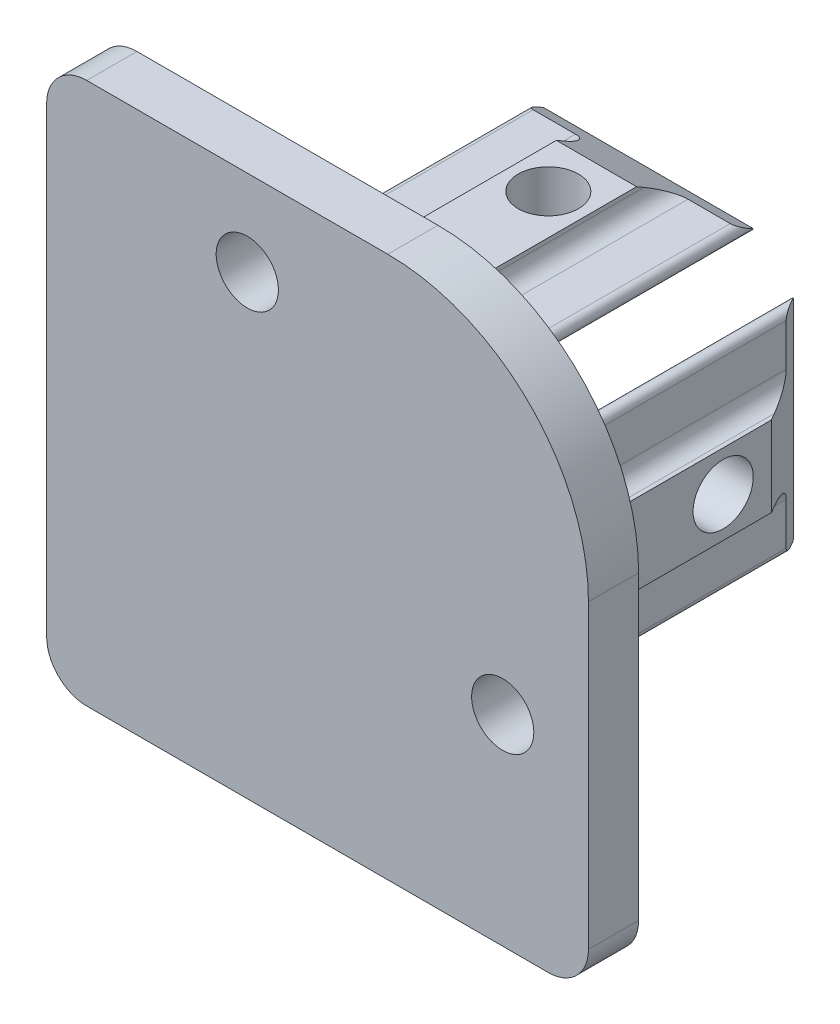
from build123d import *

# Parameters (mm, degrees)
BOSS_EXTRUDE2_DEPTH           = 20
CHAMFER2_SIZE                 = 1.5
CHAMFER2_SIZE2                = 2.598076211
SKETCH4_R                     = 1.5
CUT_EXTRUDE1_DEPTH            = 22.185810788
SKETCH6_W                     = 27
SKETCH6_H                     = 27
BOSS_EXTRUDE4_DEPTH           = 2.5
CIRPATTERN1_COUNT             = 4
CHAMFER2_OF_CIRPATTERN1_SIZE2 = 1.5
CHAMFER2_OF_CIRPATTERN1_SIZE  = 2.598076211
SKETCH10_R                    = 1.55
CUT_EXTRUDE3_DEPTH            = 32.272991606
FILLET1_R                     = 10
FILLET2_R                     = 2


with BuildPart() as part:
    # Sketch2 → Boss-Extrude2 (new body)
    with BuildSketch(Plane.XY):
        with BuildLine():
            Line((-2.860520074, 4.832233047), (-5.150943513, 7.122656487))
            ThreePointArc((-5.150943513, 7.122656487), (-5.224256058, 7.491223537), (-4.9118, 7.7))
            Line((-4.9118, 7.7), (-2.8048, 7.7))
            ThreePointArc((-2.8048, 7.7), (-2.235720463, 7.935720463), (-2, 8.5048))
            Line((-2, 8.5048), (-2, 8.7126))
            Line((-2, 8.7126), (2, 8.7126))
            Line((2, 8.7126), (2, 8.5048))
            ThreePointArc((2, 8.5048), (2.235720463, 7.935720463), (2.8048, 7.7))
            Line((2.8048, 7.7), (4.9118, 7.7))
            ThreePointArc((4.9118, 7.7), (5.224256058, 7.491223537), (5.150943513, 7.122656487))
            Line((5.150943513, 7.122656487), (2.860520074, 4.832233047))
            ThreePointArc((2.860520074, 4.832233047), (2.049461702, 4.290301169), (1.092753121, 4.1))
            Line((1.092753121, 4.1), (-1.092753121, 4.1))
            ThreePointArc((-1.092753121, 4.1), (-2.049461702, 4.290301169), (-2.860520074, 4.832233047))
        make_face()
    boss_extrude2 = extrude(amount=-BOSS_EXTRUDE2_DEPTH)

    # Chamfer2
    chamfer2_edges = [part.edges().sort_by_distance(p)[0] for p in [
        (0, 8.7126, -20),
    ]]
    chamfer2_side = [part.faces().sort_by_distance(p)[0] for p in [
        (0, 6.450366022, -20),
    ]]
    chamfer(chamfer2_edges, length=CHAMFER2_SIZE, length2=CHAMFER2_SIZE2, reference=chamfer2_side[0])

    # Sketch4 → Cut-Extrude1 (cut, through all)
    with BuildSketch(Plane(origin=(0, 8.7126, 0), x_dir=(1, 0, 0), z_dir=(0, 1, 0))):
        with Locations(Location((0, 15, 0), (0, 0, 270))):
            Circle(SKETCH4_R)
    cut_extrude1 = extrude(amount=-CUT_EXTRUDE1_DEPTH, mode=Mode.SUBTRACT)

    # Sketch6 → Boss-Extrude4 (add)
    with BuildSketch(Plane.XY):
        with Locations((3.5, 3.5)):
            Rectangle(SKETCH6_W, SKETCH6_H)
    extrude(amount=-BOSS_EXTRUDE4_DEPTH)

    # CirPattern1: Boss-Extrude2, Cut-Extrude1 ×4 about axis
    cirpattern1_axis = Axis((0, 0, 0), (0, 0, 1))
    add([boss_extrude2.rotate(cirpattern1_axis, i * 360 / CIRPATTERN1_COUNT) for i in range(1, CIRPATTERN1_COUNT)])
    add([cut_extrude1.rotate(cirpattern1_axis, i * 360 / CIRPATTERN1_COUNT) for i in range(1, CIRPATTERN1_COUNT)], mode=Mode.SUBTRACT)

    # Chamfer2 of CirPattern1
    chamfer2_of_cirpattern1_edges = [part.edges().sort_by_distance(p)[0] for p in [
        (-8.7126, 0, -20),
        (0, -8.7126, -20),
        (8.7126, 0, -20),
    ]]
    chamfer(chamfer2_of_cirpattern1_edges, length=CHAMFER2_OF_CIRPATTERN1_SIZE, length2=CHAMFER2_OF_CIRPATTERN1_SIZE2)

    # Sketch10 → Cut-Extrude3 (cut, through all)
    with BuildSketch(Plane.XY):
        with Locations((0, 12.727922061)):
            Circle(SKETCH10_R)
        with Locations((12.727922061, 0)):
            Circle(SKETCH10_R)
    extrude(amount=-CUT_EXTRUDE3_DEPTH, mode=Mode.SUBTRACT)

    # Fillet1
    fillet1_edges = [part.edges().sort_by_distance(p)[0] for p in [
        (17, 17, -1.25),
    ]]
    fillet(fillet1_edges, radius=FILLET1_R)

    # Fillet2
    fillet2_edges = [part.edges().sort_by_distance(p)[0] for p in [
        (-10, -10, -1.25),
        (-10, 17, -1.25),
        (17, -10, -1.25),
    ]]
    fillet(fillet2_edges, radius=FILLET2_R)


solid = part.part
